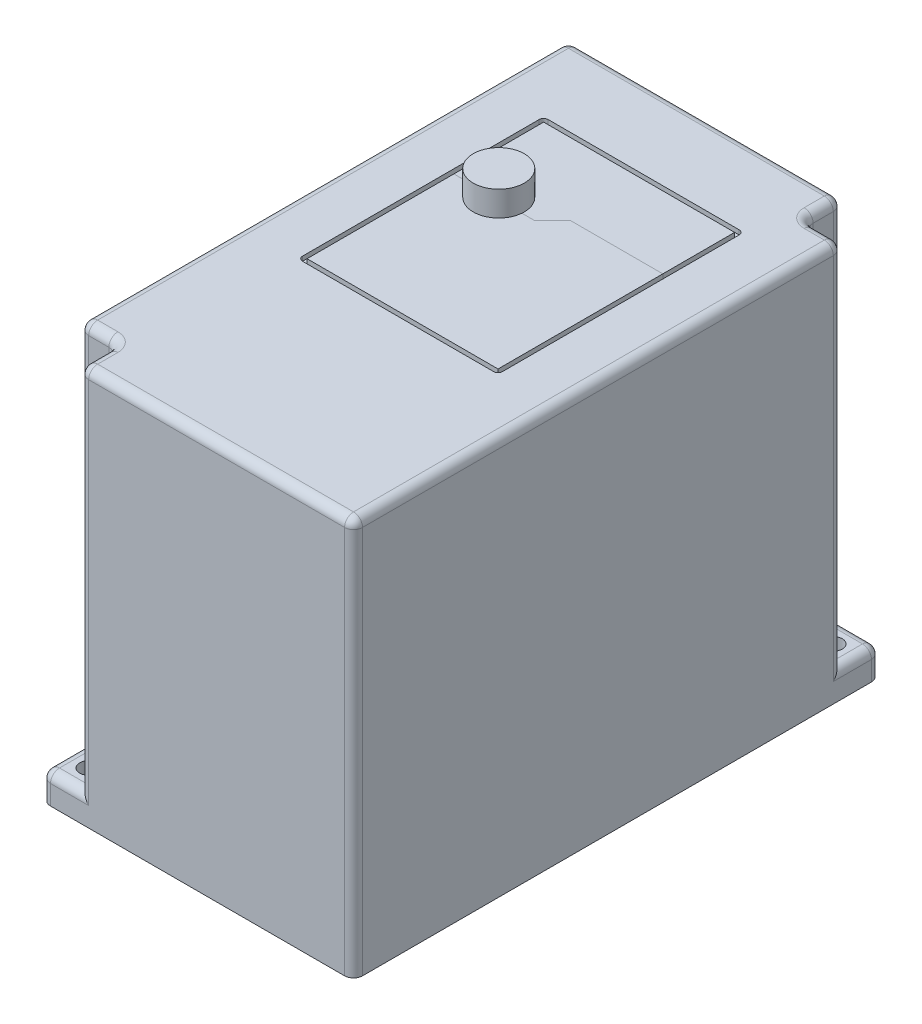
from build123d import *

# Parameters (mm, degrees)
SKETCH1_W           = 88.265
SKETCH1_H           = 149.0472
BOSS_EXTRUDE1_DEPTH = 112.395
SKETCH2_W           = 10.795
SKETCH2_H           = 10.795
CUT_EXTRUDE1_DEPTH  = 104.3305
SKETCH3_W           = 54.0258
SKETCH3_H           = 66.929
CUT_EXTRUDE2_DEPTH  = 1.27
SKETCH4_R           = 7.2136
SKETCH4_R_2         = 5.08
BOSS_EXTRUDE2_DEPTH = 7.7089
CUT_EXTRUDE5_START  = -7.7089
SKETCH7_R           = 7.2136
SKETCH7_R_2         = 5.08
CUT_EXTRUDE5_DEPTH  = 0.635
FILLET1_R           = 2.54
CUT_EXTRUDE6_DEPTH  = 2.54
BOSS_EXTRUDE3_DEPTH = 2.54
SKETCH10_R          = 2.54
CUT_EXTRUDE7_DEPTH  = 142.613105557


with BuildPart() as part:
    # Sketch1 → Boss-Extrude1 (new body)
    with BuildSketch(Plane(origin=(0, 0, 0), x_dir=(1, 0, 0), z_dir=(0, 1, 0))):
        Rectangle(SKETCH1_W, SKETCH1_H)
    extrude(amount=BOSS_EXTRUDE1_DEPTH)

    # Sketch2 → Cut-Extrude1 (cut)
    with BuildSketch(Plane(origin=(0, 112.395, 0), x_dir=(1, 0, 0), z_dir=(0, 1, 0))):
        with Locations((-38.735, -69.1261)):
            Rectangle(SKETCH2_W, SKETCH2_H)
        with Locations((38.735, 69.1261)):
            Rectangle(SKETCH2_W, SKETCH2_H)
    extrude(amount=-CUT_EXTRUDE1_DEPTH, mode=Mode.SUBTRACT)

    # Sketch3 → Cut-Extrude2 (cut)
    with BuildSketch(Plane(origin=(0, 112.395, 0), x_dir=(1, 0, 0), z_dir=(0, 1, 0))):
        with BuildLine():
            Line((-27.0129, 51.6636), (27.0129, 51.6636))
            ThreePointArc((27.0129, 51.6636), (27.910925612, 51.291625612), (28.2829, 50.3936))
            Line((28.2829, 50.3936), (28.2829, -16.5354))
            ThreePointArc((28.2829, -16.5354), (27.910925612, -17.433425612), (27.0129, -17.8054))
            Line((27.0129, -17.8054), (-27.0129, -17.8054))
            ThreePointArc((-27.0129, -17.8054), (-27.910925612, -17.433425612), (-28.2829, -16.5354))
            Line((-28.2829, -16.5354), (-28.2829, 50.3936))
            ThreePointArc((-28.2829, 50.3936), (-27.910925612, 51.291625612), (-27.0129, 51.6636))
        make_face()
        with Locations((0, 16.9291)):
            Rectangle(SKETCH3_W, SKETCH3_H, mode=Mode.SUBTRACT)
    extrude(amount=-CUT_EXTRUDE2_DEPTH, mode=Mode.SUBTRACT)

    # Sketch4 → Boss-Extrude2 (add)
    # profile 1 of 2: a face of its own
    with BuildSketch(Plane(origin=(0, 112.395, 0), x_dir=(1, 0, 0), z_dir=(0, 1, 0))):
        with Locations(Location((-14.3129, 24.9936, 0), (0, 0, 90))):
            Circle(SKETCH4_R)
        with Locations((-14.3129, 24.9936)):
            Circle(SKETCH4_R_2, mode=Mode.SUBTRACT)
    # profile 2 of 2: a face of its own
    with BuildSketch(Plane(origin=(0, 112.395, 0), x_dir=(1, 0, 0), z_dir=(0, 1, 0))):
        with Locations((-14.3129, 24.9936)):
            Circle(SKETCH4_R_2)
    extrude(amount=BOSS_EXTRUDE2_DEPTH)

    # Sketch7 → Cut-Extrude5 (cut)
    with BuildSketch(Plane(origin=(0, 120.1039, 0), x_dir=(1, 0, 0), z_dir=(0, 1, 0)).offset(CUT_EXTRUDE5_START)):
        with Locations(Location((-14.3129, 24.9936, 0), (0, 0, 90))):
            Circle(SKETCH7_R)
        with Locations(Location((-14.3129, 24.9936, 0), (0, 0, 90))):
            Circle(SKETCH7_R_2, mode=Mode.SUBTRACT)
    extrude(amount=CUT_EXTRUDE5_DEPTH, mode=Mode.SUBTRACT)

    # Fillet1
    fillet1_edges = [part.edges().sort_by_distance(p)[0] for p in [
        (-44.1325, 112.395, -5.3975),
        (-5.3975, 112.395, -74.5236),
        (5.3975, 112.395, 74.5236),
        (-44.1325, 4.03225, 74.5236),
        (44.1325, 4.03225, -74.5236),
        (-33.3375, 112.395, 69.1261),
        (-38.735, 112.395, 63.7286),
        (-38.735, 8.0645, 74.5236),
        (-33.3375, 60.22975, 74.5236),
        (-33.3375, 60.22975, 63.7286),
        (-44.1325, 60.22975, 63.7286),
        (-44.1325, 8.0645, 69.1261),
        (33.3375, 112.395, -69.1261),
        (38.735, 112.395, -63.7286),
        (38.735, 8.0645, -74.5236),
        (33.3375, 60.22975, -74.5236),
        (33.3375, 60.22975, -63.7286),
        (44.1325, 60.22975, -63.7286),
        (44.1325, 8.0645, -69.1261),
        (44.1325, 112.395, 5.3975),
        (44.1325, 56.1975, 74.5236),
        (-44.1325, 56.1975, -74.5236),
    ]]
    fillet(fillet1_edges, radius=FILLET1_R)

    # Sketch8 → Cut-Extrude6 (cut)
    with BuildSketch(Plane(origin=(0, 112.395, 0), x_dir=(1, 0, 0), z_dir=(0, 1, 0))):
        Polygon((-14.3129, 24.9936), (-27.0129, 24.9936), (-27.0129, 50.3936), (27.0129, 50.3936), (27.0129, 30.0736), (0.9271, 30.0736), (-4.1529, 24.9936), align=None)
    extrude(amount=-CUT_EXTRUDE6_DEPTH, mode=Mode.SUBTRACT)

    # Sketch10 → Cut-Extrude7 (cut, through all)
    with BuildSketch(Plane(origin=(0, 8.0645, 0), x_dir=(1, 0, 0), z_dir=(0, 1, 0))):
        with Locations(Location((-37.465, -67.8561, 0), (0, 0, 270))):
            Circle(SKETCH10_R)
        with Locations(Location((37.465, 67.8561, 0), (0, 0, 270))):
            Circle(SKETCH10_R)
    extrude(amount=-CUT_EXTRUDE7_DEPTH, mode=Mode.SUBTRACT)


with BuildPart() as body_2:
    # Sketch9 → Boss-Extrude3 (new body)
    with BuildSketch(Plane(origin=(0, 109.855, 0), x_dir=(1, 0, 0), z_dir=(0, 1, 0))):
        Polygon((-27.0129, 24.9936), (-4.1529, 24.9936), (0.9271, 30.0736), (27.0129, 30.0736), (27.0129, 50.3936), (-27.0129, 50.3936), align=None)
    extrude(amount=BOSS_EXTRUDE3_DEPTH)


solid = Compound([part.part, body_2.part])
